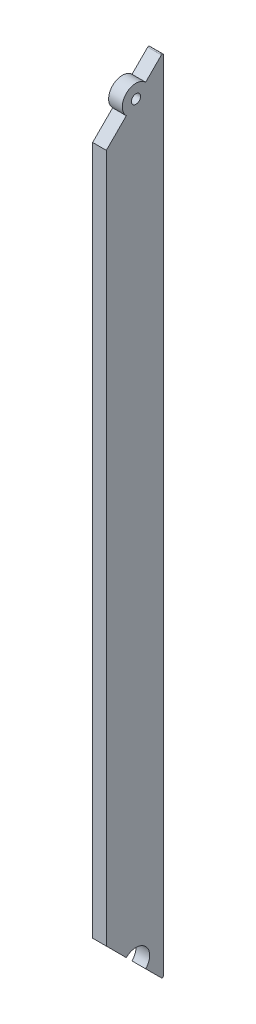
from build123d import *

# Parameters (mm, degrees)
BOSS_EXTRUDE1_DEPTH = 6
FILLET1_R           = 0.5
SKETCH4_R           = 6
BOSS_EXTRUDE2_DEPTH = 6
SKETCH3_R           = 2
SKETCH3_R_2         = 6
CUT_EXTRUDE1_DEPTH  = 353.232447151


with BuildPart() as part:
    # Sketch2 → Boss-Extrude1 (new body)
    with BuildSketch(Plane(origin=(0, 0, 0), x_dir=(0, 0, -1), z_dir=(1, 0, 0))):
        Polygon((0, 352), (0, 0), (-25, 25), (-25, 327), align=None)
    extrude(amount=BOSS_EXTRUDE1_DEPTH)

    # Fillet1
    fillet1_edges = [part.edges().sort_by_distance(p)[0] for p in [
        (3, 352, 0),
        (3, 0, 0),
    ]]
    fillet(fillet1_edges, radius=FILLET1_R)

    # Sketch4 → Boss-Extrude2 (add)
    with BuildSketch(Plane(origin=(6, 0, 0), x_dir=(0, 0, -1), z_dir=(1, 0, 0))):
        with Locations((-12, 340)):
            Circle(SKETCH4_R)
    extrude(amount=-BOSS_EXTRUDE2_DEPTH)

    # Sketch3 → Cut-Extrude1 (cut, through all)
    with BuildSketch(Plane(origin=(6, 0, 0), x_dir=(0, 0, -1), z_dir=(1, 0, 0))):
        with Locations((-12, 340)):
            Circle(SKETCH3_R)
        with Locations((-12, 12)):
            Circle(SKETCH3_R_2)
    extrude(amount=-CUT_EXTRUDE1_DEPTH, mode=Mode.SUBTRACT)


solid = part.part
